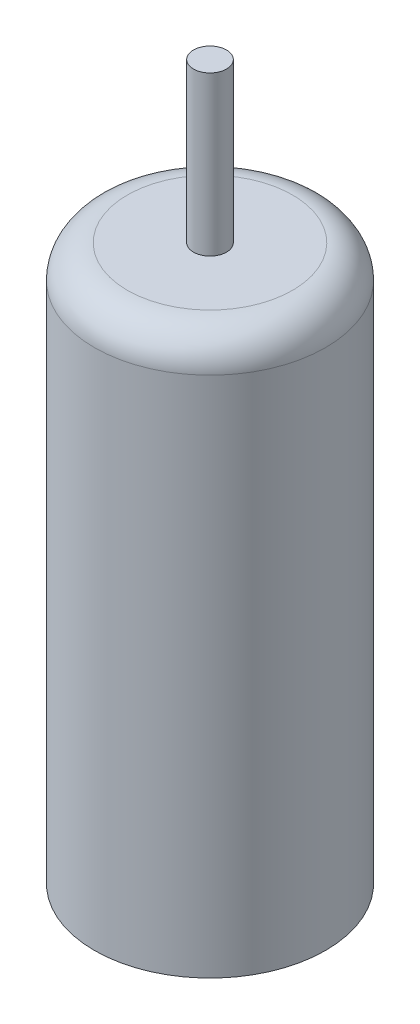
from build123d import *

# Parameters (mm, degrees)
SKETCH1_R           = 3.5
BOSS_EXTRUDE1_DEPTH = 16.8
SKETCH2_R           = 0.5
BOSS_EXTRUDE2_DEPTH = 4.8
FILLET1_R           = 1


with BuildPart() as part:
    # Sketch1 → Boss-Extrude1 (new body)
    with BuildSketch(Plane(origin=(0, 0, 0), x_dir=(1, 0, 0), z_dir=(0, 1, 0))):
        with Locations(Location((0, 0, 0), (0, 0, 270))):
            Circle(SKETCH1_R)
    extrude(amount=BOSS_EXTRUDE1_DEPTH)

    # Sketch2 → Boss-Extrude2 (add)
    with BuildSketch(Plane(origin=(0, 16.8, 0), x_dir=(1, 0, 0), z_dir=(0, 1, 0))):
        with Locations(Location((0, 0, 0), (0, 0, 270))):
            Circle(SKETCH2_R)
    extrude(amount=BOSS_EXTRUDE2_DEPTH)

    # Fillet1
    fillet1_edges = [part.edges().sort_by_distance(p)[0] for p in [
        (0, 16.8, -3.5),
    ]]
    fillet(fillet1_edges, radius=FILLET1_R)


solid = part.part
